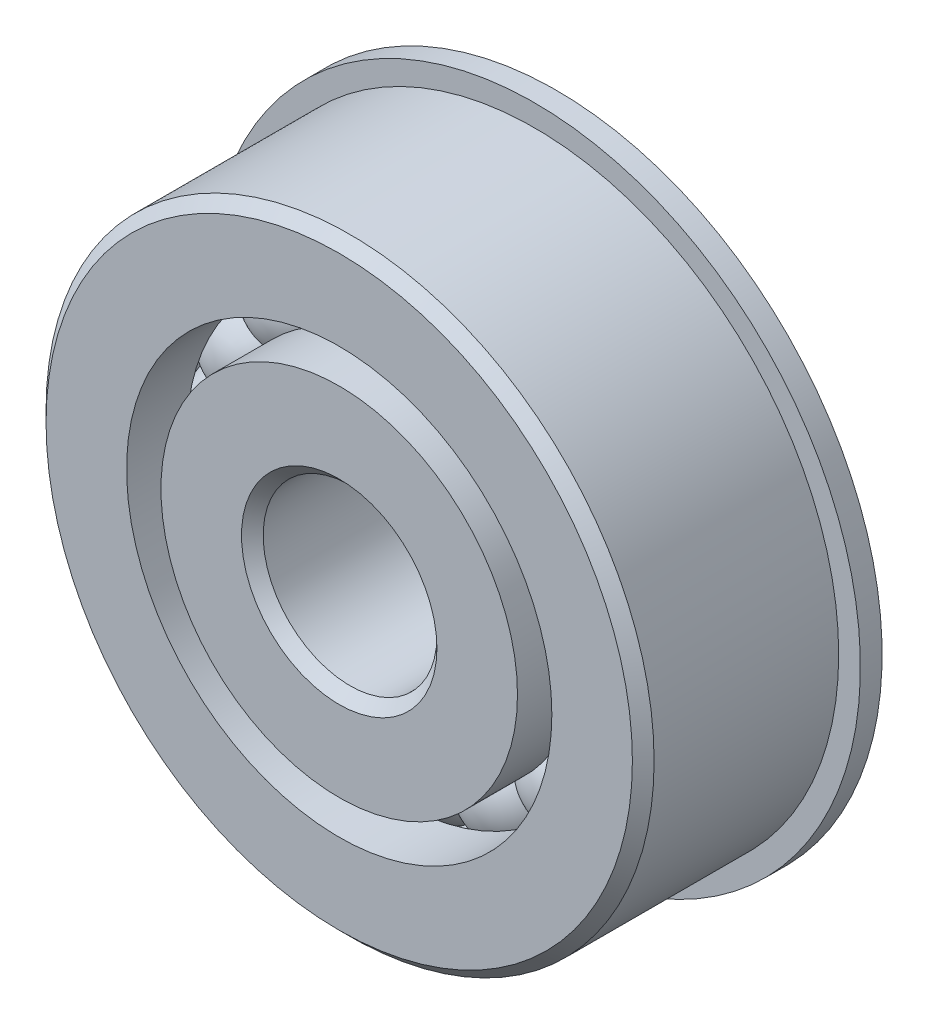
from build123d import *

# Parameters (mm, degrees)
CIRPATTERN1_COUNT = 16
SKETCH6_W         = 1.5875
SKETCH6_H         = 8.268956044


with BuildPart() as part:
    # Sketch1 → Revolve1 (revolve)
    with BuildSketch(Plane(origin=(0, 0, 0), x_dir=(0, 0, -1), z_dir=(1, 0, 0))):
        with BuildLine():
            Line((7.14375, 22.225), (-7.14375, 22.225))
            Line((-7.14375, 22.225), (-7.9375, 21.43125))
            Line((-7.9375, 21.43125), (-7.9375, 15.543543956))
            Line((-7.9375, 15.543543956), (-3.527777778, 15.543543956))
            ThreePointArc((-3.527777778, 15.543543956), (0, 18.032211266), (3.527777778, 15.543543956))
            Line((3.527777778, 15.543543956), (7.9375, 15.543543956))
            Line((7.9375, 15.543543956), (7.9375, 21.43125))
            Line((7.9375, 21.43125), (7.14375, 22.225))
        make_face()
    revolve(axis=Axis((0, 0, 7.9375), (0, 0, -1)))

    # Sketch6 → Revolve6 (revolve)
    with BuildSketch(Plane(origin=(0, 0, 0), x_dir=(0, 0, -1), z_dir=(1, 0, 0))):
        with Locations((7.14375, 19.678021978)):
            Rectangle(SKETCH6_W, SKETCH6_H)
    revolve(axis=Axis((0, 0, -7.9375), (0, 0, 1)))


with BuildPart() as body_2:
    # Sketch3 → Revolve3 (revolve)
    with BuildSketch(Plane(origin=(0, 0, 0), x_dir=(0, 0, -1), z_dir=(1, 0, 0))):
        with BuildLine():
            Line((-7.9375, 13.031456044), (-3.527777778, 13.031456044))
            ThreePointArc((-3.527777778, 13.031456044), (0, 10.542788734), (3.527777778, 13.031456044))
            Line((3.527777778, 13.031456044), (7.9375, 13.031456044))
            Line((7.9375, 13.031456044), (7.9375, 7.14375))
            Line((7.9375, 7.14375), (7.14375, 6.35))
            Line((7.14375, 6.35), (-7.14375, 6.35))
            Line((-7.14375, 6.35), (-7.9375, 7.14375))
            Line((-7.9375, 7.14375), (-7.9375, 13.031456044))
        make_face()
    revolve(axis=Axis((0, 0, 7.9375), (0, 0, -1)))


with BuildPart() as body_3:
    # Sketch4 → Revolve4 (revolve)
    with BuildSketch(Plane(origin=(0, 0, 0), x_dir=(0, 0, -1), z_dir=(1, 0, 0))):
        with BuildLine():
            Line((-3.744711266, 14.2875), (3.744711266, 14.2875))
            ThreePointArc((3.744711266, 14.2875), (0, 18.032211266), (-3.744711266, 14.2875))
        make_face()
    revolve(axis=Axis((0, 14.2875, 3.744711266), (0, 0, -1)))


with BuildPart() as cirpattern1_1:
    # CirPattern1: pattern copy
    add(body_3.part.rotate(Axis((0, 0, -7.9375), (0, 0, 1)), 1 * 360 / CIRPATTERN1_COUNT))


with BuildPart() as cirpattern1_2:
    # CirPattern1: pattern copy
    add(body_3.part.rotate(Axis((0, 0, -7.9375), (0, 0, 1)), 2 * 360 / CIRPATTERN1_COUNT))


with BuildPart() as cirpattern1_3:
    # CirPattern1: pattern copy
    add(body_3.part.rotate(Axis((0, 0, -7.9375), (0, 0, 1)), 3 * 360 / CIRPATTERN1_COUNT))


with BuildPart() as cirpattern1_4:
    # CirPattern1: pattern copy
    add(body_3.part.rotate(Axis((0, 0, -7.9375), (0, 0, 1)), 4 * 360 / CIRPATTERN1_COUNT))


with BuildPart() as cirpattern1_5:
    # CirPattern1: pattern copy
    add(body_3.part.rotate(Axis((0, 0, -7.9375), (0, 0, 1)), 5 * 360 / CIRPATTERN1_COUNT))


with BuildPart() as cirpattern1_6:
    # CirPattern1: pattern copy
    add(body_3.part.rotate(Axis((0, 0, -7.9375), (0, 0, 1)), 6 * 360 / CIRPATTERN1_COUNT))


with BuildPart() as cirpattern1_7:
    # CirPattern1: pattern copy
    add(body_3.part.rotate(Axis((0, 0, -7.9375), (0, 0, 1)), 7 * 360 / CIRPATTERN1_COUNT))


with BuildPart() as cirpattern1_8:
    # CirPattern1: pattern copy
    add(body_3.part.rotate(Axis((0, 0, -7.9375), (0, 0, 1)), 8 * 360 / CIRPATTERN1_COUNT))


with BuildPart() as cirpattern1_9:
    # CirPattern1: pattern copy
    add(body_3.part.rotate(Axis((0, 0, -7.9375), (0, 0, 1)), 9 * 360 / CIRPATTERN1_COUNT))


with BuildPart() as cirpattern1_10:
    # CirPattern1: pattern copy
    add(body_3.part.rotate(Axis((0, 0, -7.9375), (0, 0, 1)), 10 * 360 / CIRPATTERN1_COUNT))


with BuildPart() as cirpattern1_11:
    # CirPattern1: pattern copy
    add(body_3.part.rotate(Axis((0, 0, -7.9375), (0, 0, 1)), 11 * 360 / CIRPATTERN1_COUNT))


with BuildPart() as cirpattern1_12:
    # CirPattern1: pattern copy
    add(body_3.part.rotate(Axis((0, 0, -7.9375), (0, 0, 1)), 12 * 360 / CIRPATTERN1_COUNT))


with BuildPart() as cirpattern1_13:
    # CirPattern1: pattern copy
    add(body_3.part.rotate(Axis((0, 0, -7.9375), (0, 0, 1)), 13 * 360 / CIRPATTERN1_COUNT))


with BuildPart() as cirpattern1_14:
    # CirPattern1: pattern copy
    add(body_3.part.rotate(Axis((0, 0, -7.9375), (0, 0, 1)), 14 * 360 / CIRPATTERN1_COUNT))


with BuildPart() as cirpattern1_15:
    # CirPattern1: pattern copy
    add(body_3.part.rotate(Axis((0, 0, -7.9375), (0, 0, 1)), 15 * 360 / CIRPATTERN1_COUNT))


solid = Compound([part.part, body_2.part, body_3.part, cirpattern1_1.part, cirpattern1_2.part, cirpattern1_3.part, cirpattern1_4.part, cirpattern1_5.part, cirpattern1_6.part, cirpattern1_7.part, cirpattern1_8.part, cirpattern1_9.part, cirpattern1_10.part, cirpattern1_11.part, cirpattern1_12.part, cirpattern1_13.part, cirpattern1_14.part, cirpattern1_15.part])
